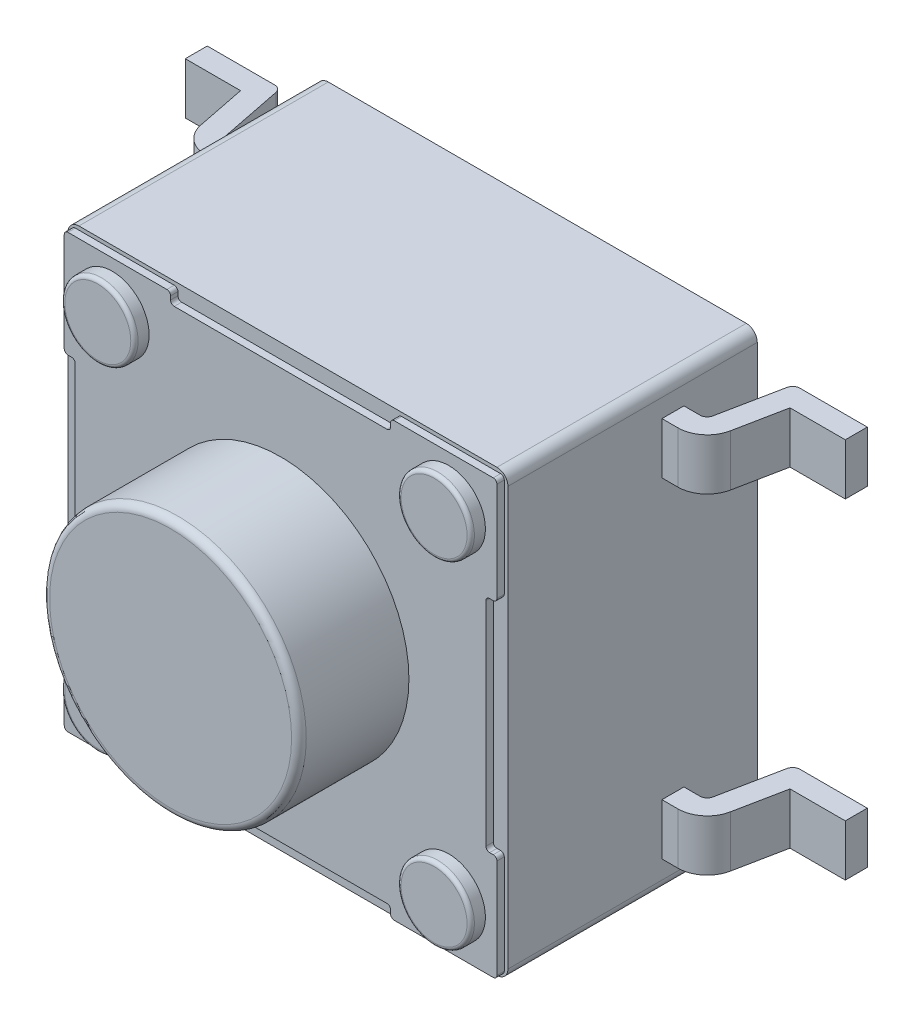
from build123d import *

# Parameters (mm, degrees)
SKETCH1_W            = 6
SKETCH1_H            = 6
BASE_EXTRUDE_DEPTH   = 3.4
BOSS_EXTRUDE1_DEPTH  = 0.1
SKETCH4_R            = 1.75
BOSS_EXTRUDE2_DEPTH  = 1.5
FILLET1_R            = 0.1
SKETCH5_R            = 0.5
BOSS_EXTRUDE3_DEPTH  = 0.2
FILLET2_R            = 0.05
BOSS_EXTRUDE4_DEPTH  = 0.35
MIRROR2_COPY_1_DEPTH = 0.35
FILLET3_R            = 0.15


with BuildPart() as part:
    # Sketch1 → Base-Extrude (new body)
    with BuildSketch(Plane.XY):
        Rectangle(SKETCH1_W, SKETCH1_H)
    extrude(amount=BASE_EXTRUDE_DEPTH)

    # Sketch3 → Boss-Extrude1 (add)
    with BuildSketch(Plane.XY.offset(3.4)):
        with BuildLine():
            Line((2.9, 2.95), (1.55, 2.95))
            ThreePointArc((1.55, 2.95), (1.514644661, 2.935355339), (1.5, 2.9))
            Line((1.5, 2.9), (1.5, 2.85))
            ThreePointArc((1.5, 2.85), (1.485355339, 2.814644661), (1.45, 2.8))
            Line((1.45, 2.8), (-1.45, 2.8))
            ThreePointArc((-1.45, 2.8), (-1.485355339, 2.814644661), (-1.5, 2.85))
            Line((-1.5, 2.85), (-1.5, 2.9))
            ThreePointArc((-1.5, 2.9), (-1.514644661, 2.935355339), (-1.55, 2.95))
            Line((-1.55, 2.95), (-2.9, 2.95))
            ThreePointArc((-2.9, 2.95), (-2.935355339, 2.935355339), (-2.95, 2.9))
            Line((-2.95, 2.9), (-2.95, 1.55))
            ThreePointArc((-2.95, 1.55), (-2.935355339, 1.514644661), (-2.9, 1.5))
            Line((-2.9, 1.5), (-2.85, 1.5))
            ThreePointArc((-2.85, 1.5), (-2.814644661, 1.485355339), (-2.8, 1.45))
            Line((-2.8, 1.45), (-2.8, -1.45))
            ThreePointArc((-2.8, -1.45), (-2.814644661, -1.485355339), (-2.85, -1.5))
            Line((-2.85, -1.5), (-2.9, -1.5))
            ThreePointArc((-2.9, -1.5), (-2.935355339, -1.514644661), (-2.95, -1.55))
            Line((-2.95, -1.55), (-2.95, -2.9))
            ThreePointArc((-2.95, -2.9), (-2.935355339, -2.935355339), (-2.9, -2.95))
            Line((-2.9, -2.95), (-1.55, -2.95))
            ThreePointArc((-1.55, -2.95), (-1.514644661, -2.935355339), (-1.5, -2.9))
            Line((-1.5, -2.9), (-1.5, -2.85))
            ThreePointArc((-1.5, -2.85), (-1.485355339, -2.814644661), (-1.45, -2.8))
            Line((-1.45, -2.8), (1.45, -2.8))
            ThreePointArc((1.45, -2.8), (1.485355339, -2.814644661), (1.5, -2.85))
            Line((1.5, -2.85), (1.5, -2.9))
            ThreePointArc((1.5, -2.9), (1.514644661, -2.935355339), (1.55, -2.95))
            Line((1.55, -2.95), (2.9, -2.95))
            ThreePointArc((2.9, -2.95), (2.935355339, -2.935355339), (2.95, -2.9))
            Line((2.95, -2.9), (2.95, -1.55))
            ThreePointArc((2.95, -1.55), (2.935355339, -1.514644661), (2.9, -1.5))
            Line((2.9, -1.5), (2.85, -1.5))
            ThreePointArc((2.85, -1.5), (2.814644661, -1.485355339), (2.8, -1.45))
            Line((2.8, -1.45), (2.8, 1.45))
            ThreePointArc((2.8, 1.45), (2.814644661, 1.485355339), (2.85, 1.5))
            Line((2.85, 1.5), (2.9, 1.5))
            ThreePointArc((2.9, 1.5), (2.935355339, 1.514644661), (2.95, 1.55))
            Line((2.95, 1.55), (2.95, 2.9))
            ThreePointArc((2.95, 2.9), (2.935355339, 2.935355339), (2.9, 2.95))
        make_face()
    extrude(amount=BOSS_EXTRUDE1_DEPTH)

    # Sketch4 → Boss-Extrude2 (add)
    with BuildSketch(Plane.XY.offset(3.5)):
        Circle(SKETCH4_R)
    extrude(amount=BOSS_EXTRUDE2_DEPTH)

    # Fillet1
    fillet1_edges = [part.edges().sort_by_distance(p)[0] for p in [
        (-1.75, 0, 5),
    ]]
    fillet(fillet1_edges, radius=FILLET1_R)

    # Sketch5 → Boss-Extrude3 (add)
    with BuildSketch(Plane.XY.offset(3.5)):
        with Locations((2.292893219, -2.292893219)):
            Circle(SKETCH5_R)
        with Locations((-2.292893219, -2.292893219)):
            Circle(SKETCH5_R)
        with Locations((-2.292893219, 2.292893219)):
            Circle(SKETCH5_R)
        with Locations((2.292893219, 2.292893219)):
            Circle(SKETCH5_R)
    extrude(amount=BOSS_EXTRUDE3_DEPTH)

    # Fillet2
    fillet2_edges = [part.edges().sort_by_distance(p)[0] for p in [
        (1.792893219, -2.292893219, 3.7),
        (-2.792893219, -2.292893219, 3.7),
        (-2.792893219, 2.292893219, 3.7),
        (1.792893219, 2.292893219, 3.7),
    ]]
    fillet(fillet2_edges, radius=FILLET2_R)

    # Sketch6 → Boss-Extrude4 (add, symmetric)
    with BuildSketch(Plane(origin=(0, -2.25, 0), x_dir=(-1, 0, 0), z_dir=(0, 1, 0))):
        with BuildLine():
            Line((-3, 1), (-3.21801961, 1))
            ThreePointArc((-3.21801961, 1), (-3.2814185, 0.977334214), (-3.316077677, 0.919611614))
            Line((-3.316077677, 0.919611614), (-3.483922323, 0.080388386))
            ThreePointArc((-3.483922323, 0.080388386), (-3.5185815, 0.022665786), (-3.58198039, 0))
            Line((-3.58198039, 0), (-4.5, 0))
            Line((-4.5, 0), (-4.5, 0.3))
            Line((-4.5, 0.3), (-3.745941171, 0.3))
            Line((-3.745941171, 0.3), (-3.61025188, 0.978446454))
            ThreePointArc((-3.61025188, 0.978446454), (-3.471615172, 1.209336857), (-3.21801961, 1.3))
            Line((-3.21801961, 1.3), (-3, 1.3))
            Line((-3, 1.3), (-3, 1))
        make_face()
    boss_extrude4 = extrude(amount=BOSS_EXTRUDE4_DEPTH, both=True)

    # Mirror1: Boss-Extrude4 across plane
    add(boss_extrude4.mirror(Plane.ZX))

    # Mirror2: Boss-Extrude4 across plane
    add(boss_extrude4.mirror(Plane(origin=(0, 0, 0), x_dir=(0, 0, 1), z_dir=(1, 0, 0))))

    # Mirror2 copy 1 sketch → Mirror2 copy 1 (add, symmetric)
    with BuildSketch(Plane.XZ.offset(-2.25)):
        with BuildLine():
            Line((-3, 1), (-3.21801961, 1))
            ThreePointArc((-3.21801961, 1), (-3.2814185, 0.977334214), (-3.316077677, 0.919611614))
            Line((-3.316077677, 0.919611614), (-3.483922323, 0.080388386))
            ThreePointArc((-3.483922323, 0.080388386), (-3.5185815, 0.022665786), (-3.58198039, 0))
            Line((-3.58198039, 0), (-4.5, 0))
            Line((-4.5, 0), (-4.5, 0.3))
            Line((-4.5, 0.3), (-3.745941171, 0.3))
            Line((-3.745941171, 0.3), (-3.61025188, 0.978446454))
            ThreePointArc((-3.61025188, 0.978446454), (-3.471615172, 1.209336857), (-3.21801961, 1.3))
            Line((-3.21801961, 1.3), (-3, 1.3))
            Line((-3, 1.3), (-3, 1))
        make_face()
    extrude(amount=MIRROR2_COPY_1_DEPTH, both=True)

    # Fillet3
    fillet3_edges = [part.edges().sort_by_distance(p)[0] for p in [
        (-3, 3, 1.7),
        (3, 3, 1.7),
        (3, -3, 1.7),
        (-3, -3, 1.7),
    ]]
    fillet(fillet3_edges, radius=FILLET3_R)


solid = part.part
